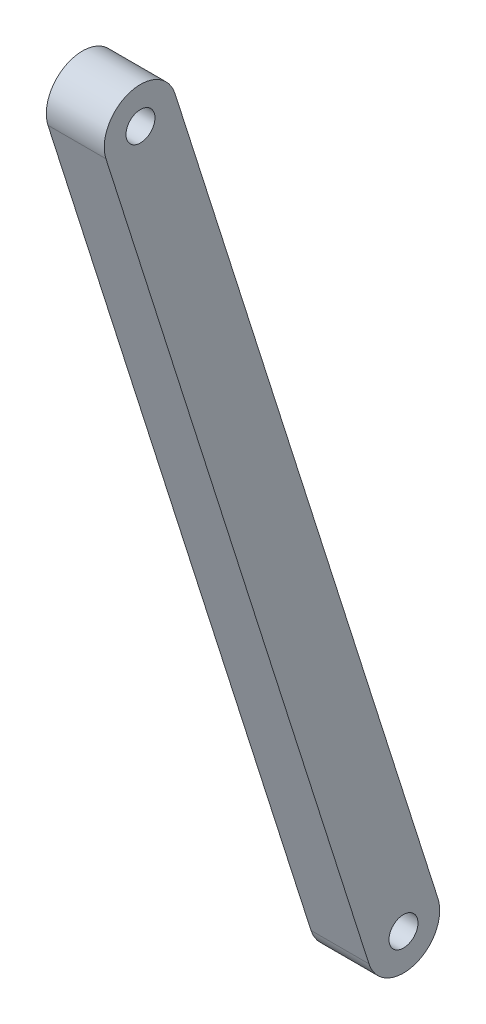
from build123d import *

# Parameters (mm, degrees)
SKETCH_4_R      = 2
EXTRUDE_2_DEPTH = 4


with BuildPart() as part:
    # 草图4 → 凸台-拉伸2 (new, symmetric)
    with BuildSketch(Plane(origin=(0, 0, 0), x_dir=(0, 0, -1), z_dir=(1, 0, 0))):
        with BuildLine():
            Line((-2.59389862, 167.833551939), (33.70474737, 53.455196035))
            ThreePointArc((33.70474737, 53.455196035), (30.451426124, 47.176987623), (24.173217711, 50.430308869))
            Line((24.173217711, 50.430308869), (-12.125428278, 164.808664773))
            ThreePointArc((-12.125428278, 164.808664773), (-8.872107032, 171.086873186), (-2.59389862, 167.833551939))
        make_face()
        with Locations((-7.359663449, 166.321108356)):
            Circle(SKETCH_4_R, mode=Mode.SUBTRACT)
        with Locations((28.938982541, 51.942752452)):
            Circle(SKETCH_4_R, mode=Mode.SUBTRACT)
    extrude(amount=EXTRUDE_2_DEPTH, both=True)


solid = part.part
